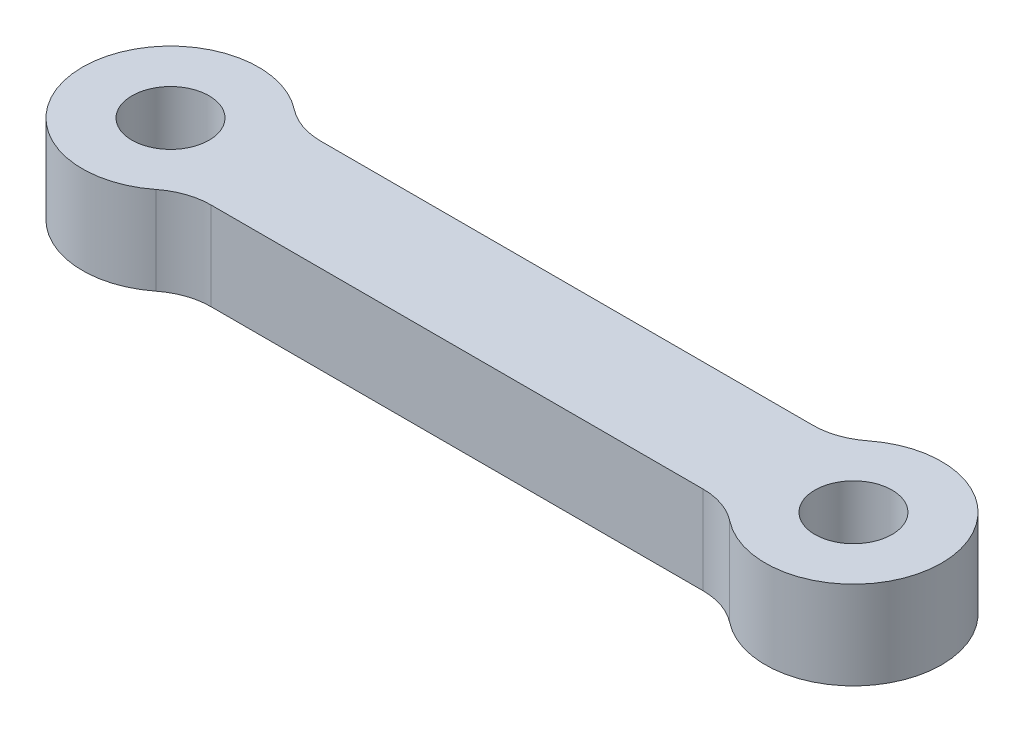
from build123d import *

# Parameters (mm, degrees)
SKETCH_1_R      = 1.75
EXTRUDE_1_DEPTH = 4
FILLET_1_R      = 3


with BuildPart() as part:
    # 草图1 → 凸台-拉伸1 (new body)
    with BuildSketch(Plane(origin=(0, 0, 0), x_dir=(1, 0, 0), z_dir=(0, 1, 0))):
        with BuildLine():
            Line((-27.877501001, 2.5), (-3.122498999, 2.5))
            ThreePointArc((-3.122498999, 2.5), (4, 0), (-3.122498999, -2.5))
            Line((-3.122498999, -2.5), (-27.877501001, -2.5))
            ThreePointArc((-27.877501001, -2.5), (-35, 0), (-27.877501001, 2.5))
        make_face()
        with Locations(Location((-31, 0, 0), (0, 0, 270))):
            Circle(SKETCH_1_R, mode=Mode.SUBTRACT)
        with Locations(Location((0, 0, 0), (0, 0, 270))):
            Circle(SKETCH_1_R, mode=Mode.SUBTRACT)
    extrude(amount=EXTRUDE_1_DEPTH)

    # 圆角1
    fillet_1_edges = [part.edges().sort_by_distance(p)[0] for p in [
        (-27.877501001, 2, -2.5),
        (-3.122498999, 2, -2.5),
        (-3.122498999, 2, 2.5),
        (-27.877501001, 2, 2.5),
    ]]
    fillet(fillet_1_edges, radius=FILLET_1_R)


solid = part.part
